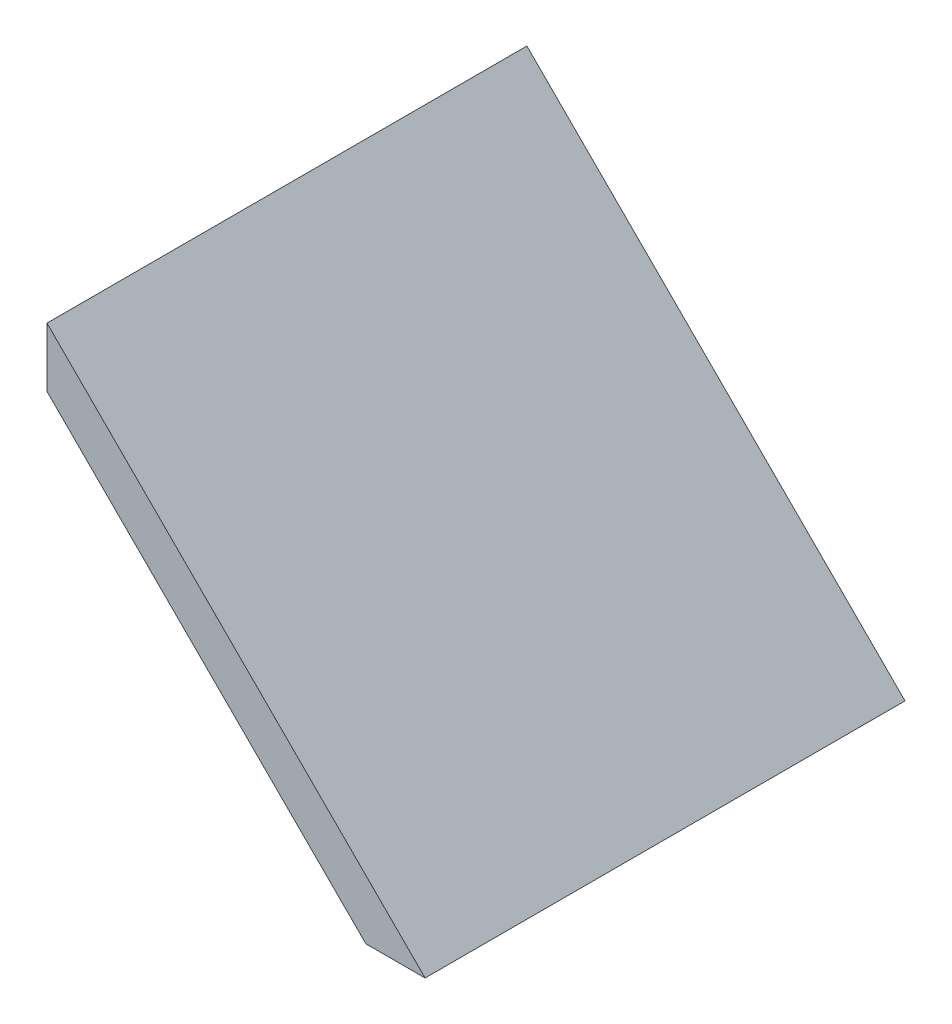
from build123d import *

# Parameters (mm, degrees)
BOSS_EXTRUDE1_DEPTH = 172


with BuildPart() as part:
    # Sketch1 → Boss-Extrude1 (new body)
    with BuildSketch(Plane.XY):
        Polygon((114.3, 0), (0, 114.3), (0, 135.513203436), (135.513203436, 0), align=None)
    extrude(amount=BOSS_EXTRUDE1_DEPTH)


solid = part.part
